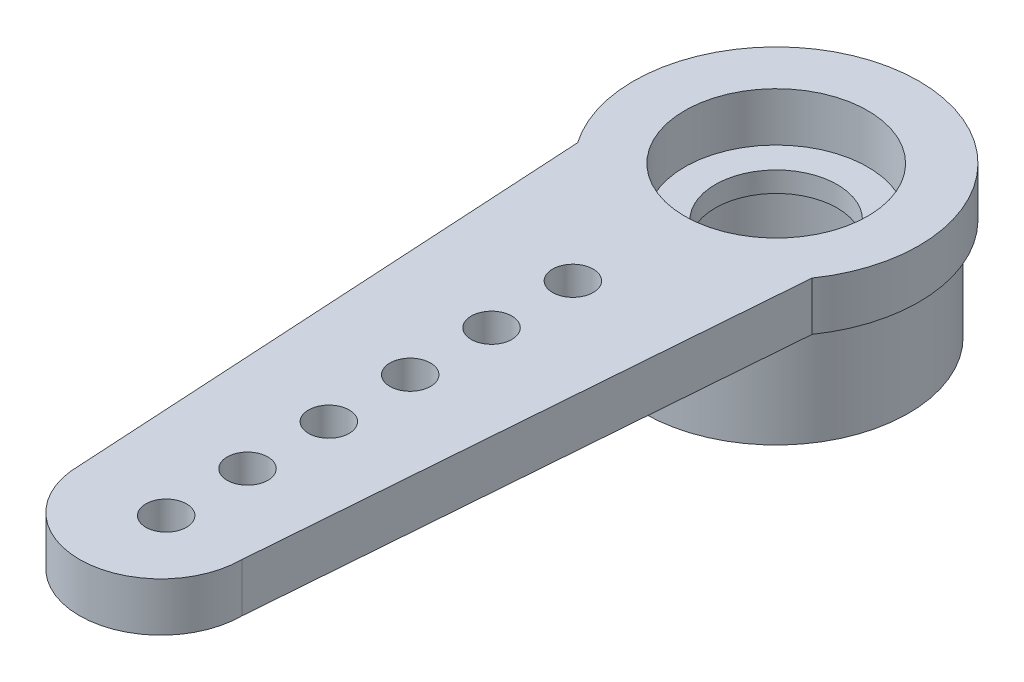
from build123d import *

# Parameters (mm, degrees)
SKETCH1_R           = 0.5
SKETCH1_R_2         = 3.508270012
SKETCH1_R_3         = 2.25
BOSS_EXTRUDE1_DEPTH = 1.2
SKETCH2_R           = 3.25
SKETCH2_R_2         = 1.5
BOSS_EXTRUDE2_DEPTH = 2.5
SKETCH3_R           = 2.5
CUT_EXTRUDE1_DEPTH  = 2


with BuildPart() as part:
    # Sketch1 → Boss-Extrude1 (new body)
    # profile 1 of 2: a face of its own
    with BuildSketch(Plane(origin=(0, 0, 0), x_dir=(1, 0, 0), z_dir=(0, 1, 0))):
        with BuildLine():
            ThreePointArc((2.882352941, -2), (0, -3.508270012), (-2.882352941, -2))
            Line((-2.882352941, -2), (-2.132352941, -14.999416075))
            ThreePointArc((-2.132352941, -14.999416075), (-0.132626782, -16.99941606), (1.867646984, -14.999963756))
            Line((1.867646984, -14.999963756), (2.882352941, -2))
        make_face()
        with Locations(Location((0, -15, 0), (0, 0, 270))):
            Circle(SKETCH1_R, mode=Mode.SUBTRACT)
        with Locations(Location((0, -13, 0), (0, 0, 270))):
            Circle(SKETCH1_R, mode=Mode.SUBTRACT)
        with Locations(Location((0, -11, 0), (0, 0, 270))):
            Circle(SKETCH1_R, mode=Mode.SUBTRACT)
        with Locations(Location((0, -9, 0), (0, 0, 270))):
            Circle(SKETCH1_R, mode=Mode.SUBTRACT)
        with Locations(Location((0, -7, 0), (0, 0, 270))):
            Circle(SKETCH1_R, mode=Mode.SUBTRACT)
        with Locations(Location((0, -5, 0), (0, 0, 270))):
            Circle(SKETCH1_R, mode=Mode.SUBTRACT)
    # profile 2 of 2: a face of its own
    with BuildSketch(Plane(origin=(0, 0, 0), x_dir=(1, 0, 0), z_dir=(0, 1, 0))):
        Circle(SKETCH1_R_2)
        with Locations(Location((0, 0, 0), (0, 0, 270))):
            Circle(SKETCH1_R_3, mode=Mode.SUBTRACT)
    extrude(amount=BOSS_EXTRUDE1_DEPTH)

    # Sketch2 → Boss-Extrude2 (add)
    with BuildSketch(Plane(origin=(0, 0, 0), x_dir=(1, 0, 0), z_dir=(0, 1, 0))):
        with Locations(Location((0, 0, 0), (0, 0, 270))):
            Circle(SKETCH2_R)
        with Locations(Location((0, 0, 0), (0, 0, 270))):
            Circle(SKETCH2_R_2, mode=Mode.SUBTRACT)
    extrude(amount=-BOSS_EXTRUDE2_DEPTH)

    # Sketch3 → Cut-Extrude1 (cut)
    with BuildSketch(Plane.XZ.offset(2.5)):
        with Locations(Location((0, 0, 0), (0, 0, 270))):
            Circle(SKETCH3_R)
    extrude(amount=-CUT_EXTRUDE1_DEPTH, mode=Mode.SUBTRACT)


solid = part.part
